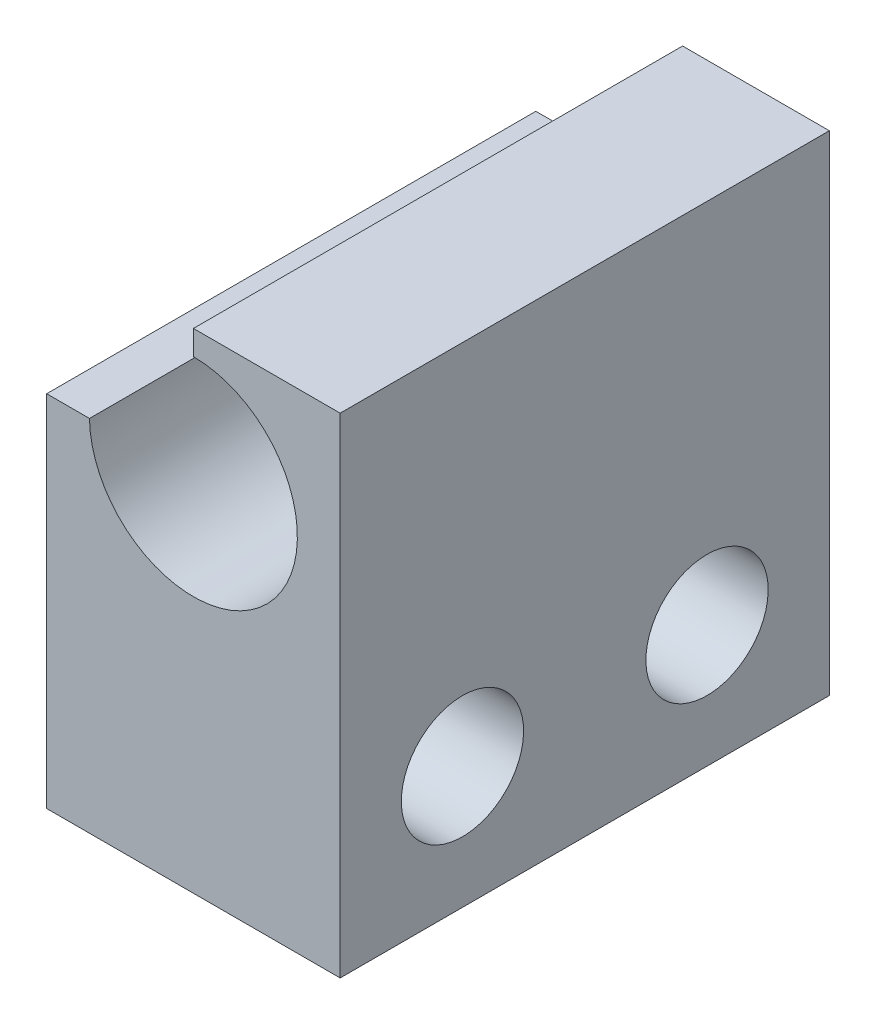
from build123d import *

# Parameters (mm, degrees)
BOSS_EXTRUDE1_DEPTH = 25.4
SKETCH2_R           = 3.175
CUT_EXTRUDE1_DEPTH  = 25.4


with BuildPart() as part:
    # Sketch1 → Boss-Extrude1 (new body)
    with BuildSketch(Plane.XY):
        with BuildLine():
            Line((-9.010920048, 10.647675717), (-11.233987821, 10.647675717))
            Line((-11.233987821, 10.647675717), (-11.233987821, -8.006537715))
            Line((-11.233987821, -8.006537715), (4.006012179, -8.006537715))
            Line((4.006012179, -8.006537715), (4.006012179, 17.393462285))
            Line((4.006012179, 17.393462285), (-3.613987821, 17.393462285))
            Line((-3.613987821, 17.393462285), (-3.613987821, 16.123462285))
            ThreePointArc((-3.613987821, 16.123462285), (0.23019987, 6.937133014), (-9.010920048, 10.647675717))
        make_face()
    extrude(amount=BOSS_EXTRUDE1_DEPTH)

    # Sketch2 → Cut-Extrude1 (cut)
    with BuildSketch(Plane(origin=(4.006012179, 0, 0), x_dir=(0, 0, -1), z_dir=(1, 0, 0))):
        with Locations(Location((-19.05, -1.656537715, 0), (0, 0, 90))):
            Circle(SKETCH2_R)
        with Locations(Location((-6.35, -1.656537715, 0), (0, 0, 90))):
            Circle(SKETCH2_R)
    extrude(amount=-CUT_EXTRUDE1_DEPTH, mode=Mode.SUBTRACT)


solid = part.part
